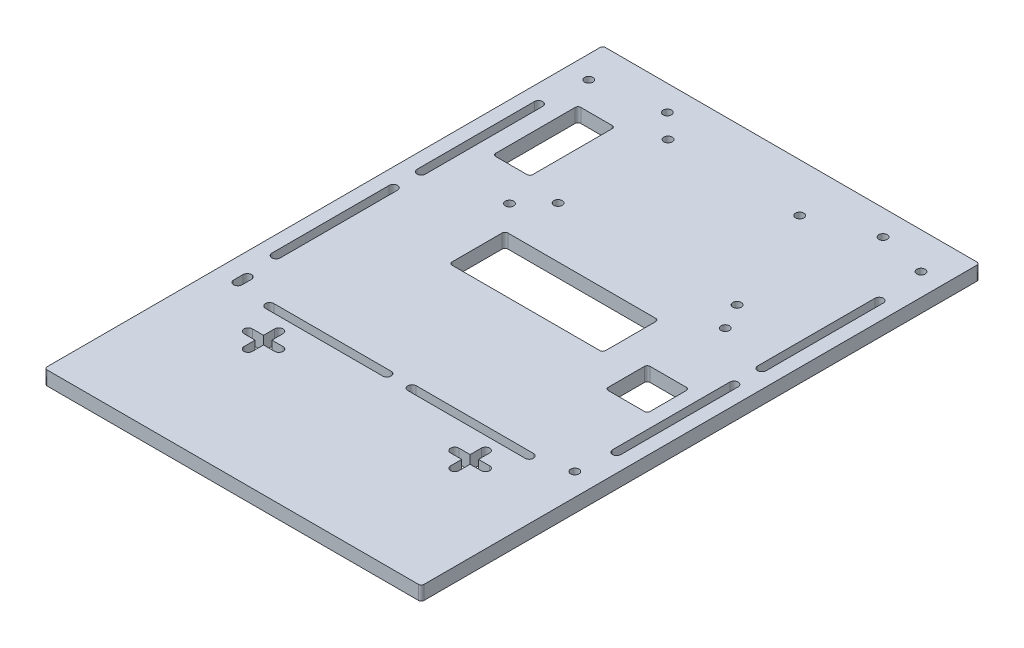
from build123d import *

# Parameters (mm, degrees)
BOSS_EXTRUDE1_DEPTH = 5
CUT_EXTRUDE1_DEPTH  = 5
CUT_EXTRUDE2_DEPTH  = 5
SKETCH5_R           = 1.5
CUT_EXTRUDE3_DEPTH  = 5
CUT_EXTRUDE4_DEPTH  = 5
SKETCH6_R           = 1.5
CUT_EXTRUDE5_DEPTH  = 5
SKETCH7_R           = 1.5
CUT_EXTRUDE6_DEPTH  = 10


with BuildPart() as part:
    # Sketch1 → Boss-Extrude1 (new body)
    with BuildSketch(Plane(origin=(0, 0, 0), x_dir=(1, 0, 0), z_dir=(0, 1, 0))):
        with BuildLine():
            Line((-67.442622951, -147.745901639), (65.557377049, -147.745901639))
            ThreePointArc((65.557377049, -147.745901639), (66.26448383, -147.453008421), (66.557377049, -146.745901639))
            Line((66.557377049, -146.745901639), (66.557377049, 51.254098361))
            ThreePointArc((66.557377049, 51.254098361), (66.26448383, 51.961205142), (65.557377049, 52.254098361))
            Line((65.557377049, 52.254098361), (-67.442622951, 52.254098361))
            ThreePointArc((-67.442622951, 52.254098361), (-68.149729732, 51.961205142), (-68.442622951, 51.254098361))
            Line((-68.442622951, 51.254098361), (-68.442622951, -146.745901639))
            ThreePointArc((-68.442622951, -146.745901639), (-68.149729732, -147.453008421), (-67.442622951, -147.745901639))
        make_face()
    extrude(amount=BOSS_EXTRUDE1_DEPTH)

    # Sketch2 → Cut-Extrude1 (cut)
    with BuildSketch(Plane(origin=(0, 5, 0), x_dir=(1, 0, 0), z_dir=(0, 1, 0))):
        with BuildLine():
            Line((58.557377049, -71.245901639), (58.557377049, -29.245901639))
            ThreePointArc((58.557377049, -29.245901639), (60.057377049, -27.745901639), (61.557377049, -29.245901639))
            Line((61.557377049, -29.245901639), (61.557377049, -71.245901639))
            ThreePointArc((61.557377049, -71.245901639), (60.057377049, -72.745901639), (58.557377049, -71.245901639))
        make_face()
        with BuildLine():
            Line((58.557377049, -19.245901639), (58.557377049, 22.754098361))
            ThreePointArc((58.557377049, 22.754098361), (60.057377049, 24.254098361), (61.557377049, 22.754098361))
            Line((61.557377049, 22.754098361), (61.557377049, -19.245901639))
            ThreePointArc((61.557377049, -19.245901639), (60.057377049, -20.745901639), (58.557377049, -19.245901639))
        make_face()
        with BuildLine():
            Line((-60.442622951, -71.245901639), (-60.442622951, -29.245901639))
            ThreePointArc((-60.442622951, -29.245901639), (-61.942622951, -27.745901639), (-63.442622951, -29.245901639))
            Line((-63.442622951, -29.245901639), (-63.442622951, -71.245901639))
            ThreePointArc((-63.442622951, -71.245901639), (-61.942622951, -72.745901639), (-60.442622951, -71.245901639))
        make_face()
        with BuildLine():
            Line((-60.442622951, -19.245901639), (-60.442622951, 22.754098361))
            ThreePointArc((-60.442622951, 22.754098361), (-61.942622951, 24.254098361), (-63.442622951, 22.754098361))
            Line((-63.442622951, 22.754098361), (-63.442622951, -19.245901639))
            ThreePointArc((-63.442622951, -19.245901639), (-61.942622951, -20.745901639), (-60.442622951, -19.245901639))
        make_face()
    extrude(amount=-CUT_EXTRUDE1_DEPTH, mode=Mode.SUBTRACT)

    # Sketch3 → Cut-Extrude2 (cut)
    with BuildSketch(Plane(origin=(0, 5, 0), x_dir=(1, 0, 0), z_dir=(0, 1, 0))):
        with BuildLine():
            Line((-47.442622951, -86.545901639), (-5.442622951, -86.545901639))
            ThreePointArc((-5.442622951, -86.545901639), (-3.942622951, -88.045901639), (-5.442622951, -89.545901639))
            Line((-5.442622951, -89.545901639), (-47.442622951, -89.545901639))
            ThreePointArc((-47.442622951, -89.545901639), (-48.942622951, -88.045901639), (-47.442622951, -86.545901639))
        make_face()
        with BuildLine():
            Line((3.557377049, -86.545901639), (45.557377049, -86.545901639))
            ThreePointArc((45.557377049, -86.545901639), (47.057377049, -88.045901639), (45.557377049, -89.545901639))
            Line((45.557377049, -89.545901639), (3.557377049, -89.545901639))
            ThreePointArc((3.557377049, -89.545901639), (2.057377049, -88.045901639), (3.557377049, -86.545901639))
        make_face()
    extrude(amount=-CUT_EXTRUDE2_DEPTH, mode=Mode.SUBTRACT)

    # Sketch5 → Cut-Extrude3 (cut)
    with BuildSketch(Plane(origin=(0, 5, 0), x_dir=(1, 0, 0), z_dir=(0, 1, 0))):
        with Locations(Location((58.557377049, -84.745901639, 0), (0, 0, 270))):
            Circle(SKETCH5_R)
        with Locations(Location((58.557377049, 39.254098361, 0), (0, 0, 90))):
            Circle(SKETCH5_R)
        with Locations(Location((-60.442622951, 39.254098361, 0), (0, 0, 270))):
            Circle(SKETCH5_R)
        with BuildLine():
            Line((-58.942622951, -83.068904194), (-58.942622951, -86.422899085))
            ThreePointArc((-58.942622951, -86.422899085), (-60.442622951, -87.922899085), (-61.942622951, -86.422899085))
            Line((-61.942622951, -86.422899085), (-61.942622951, -83.068904194))
            ThreePointArc((-61.942622951, -83.068904194), (-60.442622951, -81.568904194), (-58.942622951, -83.068904194))
        make_face()
    extrude(amount=-CUT_EXTRUDE3_DEPTH, mode=Mode.SUBTRACT)

    # Sketch4 → Cut-Extrude4 (cut)
    with BuildSketch(Plane(origin=(0, 5, 0), x_dir=(1, 0, 0), z_dir=(0, 1, 0))):
        with BuildLine():
            Line((-27.442622951, -22.745901639), (25.557377049, -22.745901639))
            ThreePointArc((25.557377049, -22.745901639), (26.26448383, -23.038794858), (26.557377049, -23.745901639))
            Line((26.557377049, -23.745901639), (26.557377049, -41.745901639))
            ThreePointArc((26.557377049, -41.745901639), (26.26448383, -42.453008421), (25.557377049, -42.745901639))
            Line((25.557377049, -42.745901639), (-27.442622951, -42.745901639))
            ThreePointArc((-27.442622951, -42.745901639), (-28.149729732, -42.453008421), (-28.442622951, -41.745901639))
            Line((-28.442622951, -41.745901639), (-28.442622951, -23.745901639))
            ThreePointArc((-28.442622951, -23.745901639), (-28.149729732, -23.038794858), (-27.442622951, -22.745901639))
        make_face()
    extrude(amount=-CUT_EXTRUDE4_DEPTH, mode=Mode.SUBTRACT)

    # Sketch6 → Cut-Extrude5 (cut)
    with BuildSketch(Plane(origin=(0, 5, 0), x_dir=(1, 0, 0), z_dir=(0, 1, 0))):
        with Locations(Location((-36.251799608, 43.183284391, 0), (0, 0, 270))):
            Circle(SKETCH6_R)
        with Locations(Location((-36.251799608, -13.337715609, 0), (0, 0, 270))):
            Circle(SKETCH6_R)
        with Locations(Location((41.030032564, -13.337715609, 0), (0, 0, 270))):
            Circle(SKETCH6_R)
        with Locations(Location((41.030032564, 43.183284391, 0), (0, 0, 270))):
            Circle(SKETCH6_R)
        with BuildLine():
            Line((-53.327467893, 29.269104752), (-42.086468598, 29.269104752))
            ThreePointArc((-42.086468598, 29.269104752), (-41.379361817, 28.976211533), (-41.086468598, 28.269104752))
            Line((-41.086468598, 28.269104752), (-41.086468598, -0.204578889))
            ThreePointArc((-41.086468598, -0.204578889), (-41.379361817, -0.911685671), (-42.086468598, -1.204578889))
            Line((-42.086468598, -1.204578889), (-53.327467893, -1.204578889))
            ThreePointArc((-53.327467893, -1.204578889), (-54.034574674, -0.911685671), (-54.327467893, -0.204578889))
            Line((-54.327467893, -0.204578889), (-54.327467893, 28.269104752))
            ThreePointArc((-54.327467893, 28.269104752), (-54.034574674, 28.976211533), (-53.327467893, 29.269104752))
        make_face()
        with BuildLine():
            Line((39.416322558, -38.655645532), (52.416322558, -38.655645532))
            ThreePointArc((52.416322558, -38.655645532), (53.123429339, -38.948538751), (53.416322558, -39.655645532))
            Line((53.416322558, -39.655645532), (53.416322558, -52.655645532))
            ThreePointArc((53.416322558, -52.655645532), (53.123429339, -53.362752313), (52.416322558, -53.655645532))
            Line((52.416322558, -53.655645532), (39.416322558, -53.655645532))
            ThreePointArc((39.416322558, -53.655645532), (38.709215777, -53.362752313), (38.416322558, -52.655645532))
            Line((38.416322558, -52.655645532), (38.416322558, -39.655645532))
            ThreePointArc((38.416322558, -39.655645532), (38.709215777, -38.948538751), (39.416322558, -38.655645532))
        make_face()
        with BuildLine():
            Line((37.557377049, -94.245901639), (37.557377049, -98.245901639))
            Line((37.557377049, -98.245901639), (41.557377049, -98.245901639))
            ThreePointArc((41.557377049, -98.245901639), (43.057377049, -99.745901639), (41.557377049, -101.245901639))
            Line((41.557377049, -101.245901639), (37.557377049, -101.245901639))
            Line((37.557377049, -101.245901639), (37.557377049, -105.245901639))
            ThreePointArc((37.557377049, -105.245901639), (36.057377049, -106.745901639), (34.557377049, -105.245901639))
            Line((34.557377049, -105.245901639), (34.557377049, -101.245901639))
            Line((34.557377049, -101.245901639), (30.557377049, -101.245901639))
            ThreePointArc((30.557377049, -101.245901639), (29.057377049, -99.745901639), (30.557377049, -98.245901639))
            Line((30.557377049, -98.245901639), (34.557377049, -98.245901639))
            Line((34.557377049, -98.245901639), (34.557377049, -94.245901639))
            ThreePointArc((34.557377049, -94.245901639), (36.057377049, -92.745901639), (37.557377049, -94.245901639))
        make_face()
        with BuildLine():
            Line((-43.442622951, -98.245901639), (-39.442622951, -98.245901639))
            Line((-39.442622951, -98.245901639), (-39.442622951, -94.245901639))
            ThreePointArc((-39.442622951, -94.245901639), (-37.942622951, -92.745901639), (-36.442622951, -94.245901639))
            Line((-36.442622951, -94.245901639), (-36.442622951, -98.245901639))
            Line((-36.442622951, -98.245901639), (-32.442622951, -98.245901639))
            ThreePointArc((-32.442622951, -98.245901639), (-30.942622951, -99.745901639), (-32.442622951, -101.245901639))
            Line((-32.442622951, -101.245901639), (-36.442622951, -101.245901639))
            Line((-36.442622951, -101.245901639), (-36.442622951, -105.245901639))
            ThreePointArc((-36.442622951, -105.245901639), (-37.942622951, -106.745901639), (-39.442622951, -105.245901639))
            Line((-39.442622951, -105.245901639), (-39.442622951, -101.245901639))
            Line((-39.442622951, -101.245901639), (-43.442622951, -101.245901639))
            ThreePointArc((-43.442622951, -101.245901639), (-44.942622951, -99.745901639), (-43.442622951, -98.245901639))
        make_face()
    extrude(amount=-CUT_EXTRUDE5_DEPTH, mode=Mode.SUBTRACT)

    # Sketch7 → Cut-Extrude6 (cut)
    with BuildSketch(Plane(origin=(0, 5, 0), x_dir=(1, 0, 0), z_dir=(0, 1, 0))):
        with Locations(Location((-27.742619724, -4.439577259, 0), (0, 0, 270))):
            Circle(SKETCH7_R)
        with Locations(Location((35.925380276, -3.999577259, 0), (0, 0, 270))):
            Circle(SKETCH7_R)
        with Locations(Location((-27.742619724, 34.937422741, 0), (0, 0, 270))):
            Circle(SKETCH7_R)
        with Locations(Location((19.434380276, 34.937422741, 0), (0, 0, 270))):
            Circle(SKETCH7_R)
    extrude(amount=-CUT_EXTRUDE6_DEPTH, mode=Mode.SUBTRACT)


solid = part.part
